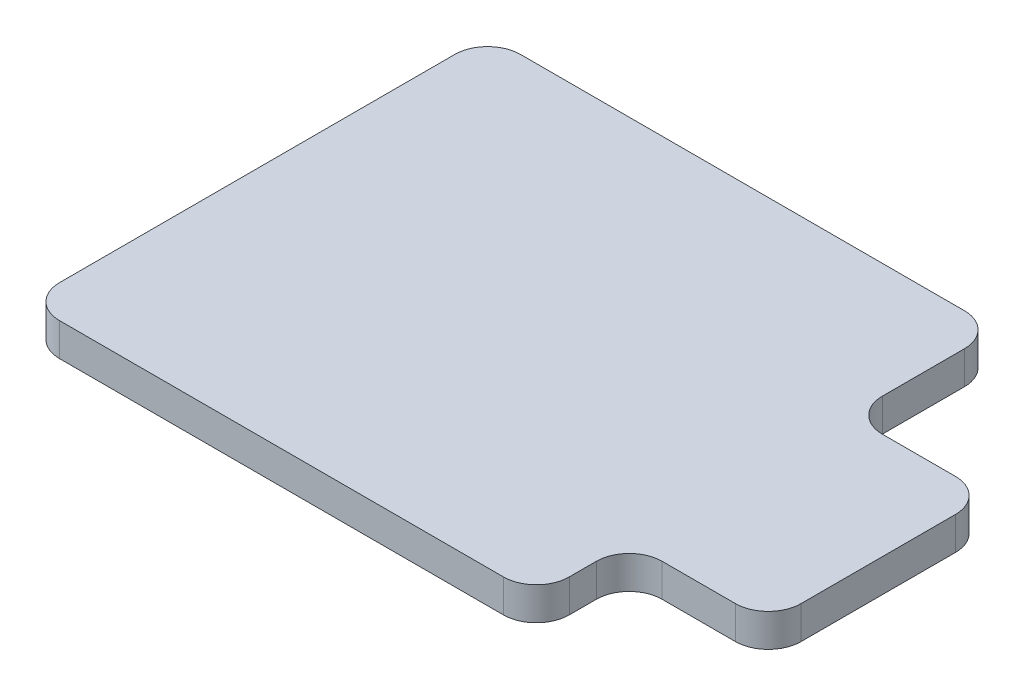
from build123d import *

# Parameters (mm, degrees)
BOSS_EXTRUDE1_DEPTH = 2.54


with BuildPart() as part:
    # Sketch1 → Boss-Extrude1 (new body)
    with BuildSketch(Plane(origin=(0, 0, 0), x_dir=(1, 0, 0), z_dir=(0, 1, 0))):
        with BuildLine():
            Line((19.658181164, 8.90701227), (19.658181164, 15.24))
            ThreePointArc((19.658181164, 15.24), (18.914232389, 17.036051224), (17.118181164, 17.78))
            Line((17.118181164, 17.78), (-17.118181164, 17.78))
            ThreePointArc((-17.118181164, 17.78), (-18.914232389, 17.036051224), (-19.658181164, 15.24))
            Line((-19.658181164, 15.24), (-19.658181164, -15.24))
            ThreePointArc((-19.658181164, -15.24), (-18.914232389, -17.036051224), (-17.118181164, -17.78))
            Line((-17.118181164, -17.78), (17.118181164, -17.78))
            ThreePointArc((17.118181164, -17.78), (18.914232389, -17.036051224), (19.658181164, -15.24))
            Line((19.658181164, -15.24), (19.658181164, -13.155891848))
            ThreePointArc((19.658181164, -13.155891848), (20.40212994, -11.359840624), (22.198181164, -10.615891848))
            Line((22.198181164, -10.615891848), (27.839818836, -10.615891848))
            ThreePointArc((27.839818836, -10.615891848), (29.63587006, -9.871943072), (30.379818836, -8.075891848))
            Line((30.379818836, -8.075891848), (30.379818836, 3.82701227))
            ThreePointArc((30.379818836, 3.82701227), (29.63587006, 5.623063494), (27.839818836, 6.36701227))
            Line((27.839818836, 6.36701227), (22.198181164, 6.36701227))
            ThreePointArc((22.198181164, 6.36701227), (20.40212994, 7.110961045), (19.658181164, 8.90701227))
        make_face()
    extrude(amount=BOSS_EXTRUDE1_DEPTH)


solid = part.part
